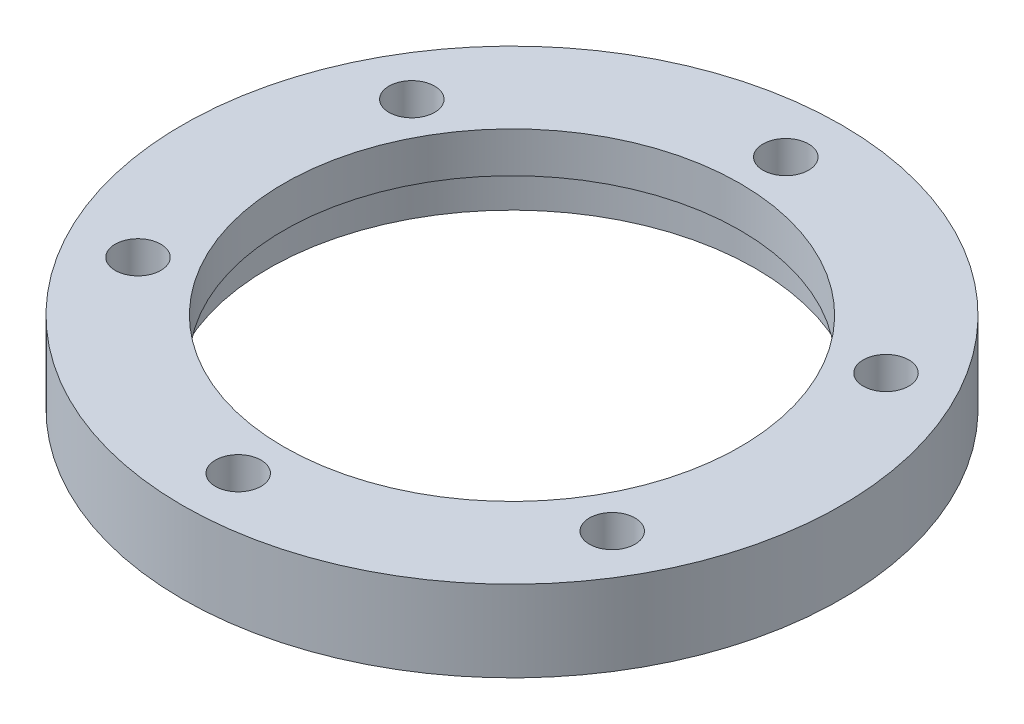
from build123d import *

# Parameters (mm, degrees)
SKETCH2_R          = 2.25
CUT_EXTRUDE1_DEPTH = 10


with BuildPart() as part:
    # Sketch1 → Revolve1 (revolve)
    with BuildSketch(Plane.XY, mode=Mode.PRIVATE) as revolve1_sk:
        Polygon((-32.5, 0), (-32.5, 8), (-22.5, 8), (-22.5, 4), (-24, 4), (-24, 0), align=None)
    revolve(revolve1_sk.sketch.rotate(Axis((0, 0, 0), (0, 1, 0)), 270), axis=Axis((0, 0, 0), (0, 1, 0)))

    # Sketch2 → Cut-Extrude1 (cut)
    with BuildSketch(Plane(origin=(0, 8, 0), x_dir=(1, 0, 0), z_dir=(0, 1, 0))):
        with Locations(Location((0, 27, 0), (0, 0, 270))):
            Circle(SKETCH2_R)
        with Locations(Location((23.382685902, 13.5, 0), (0, 0, 270))):
            Circle(SKETCH2_R)
        with Locations(Location((23.382685902, -13.5, 0), (0, 0, 270))):
            Circle(SKETCH2_R)
        with Locations(Location((0, -27, 0), (0, 0, 270))):
            Circle(SKETCH2_R)
        with Locations(Location((-23.382685902, -13.5, 0), (0, 0, 270))):
            Circle(SKETCH2_R)
        with Locations(Location((-23.382685902, 13.5, 0), (0, 0, 270))):
            Circle(SKETCH2_R)
    extrude(amount=-CUT_EXTRUDE1_DEPTH, mode=Mode.SUBTRACT)


solid = part.part
